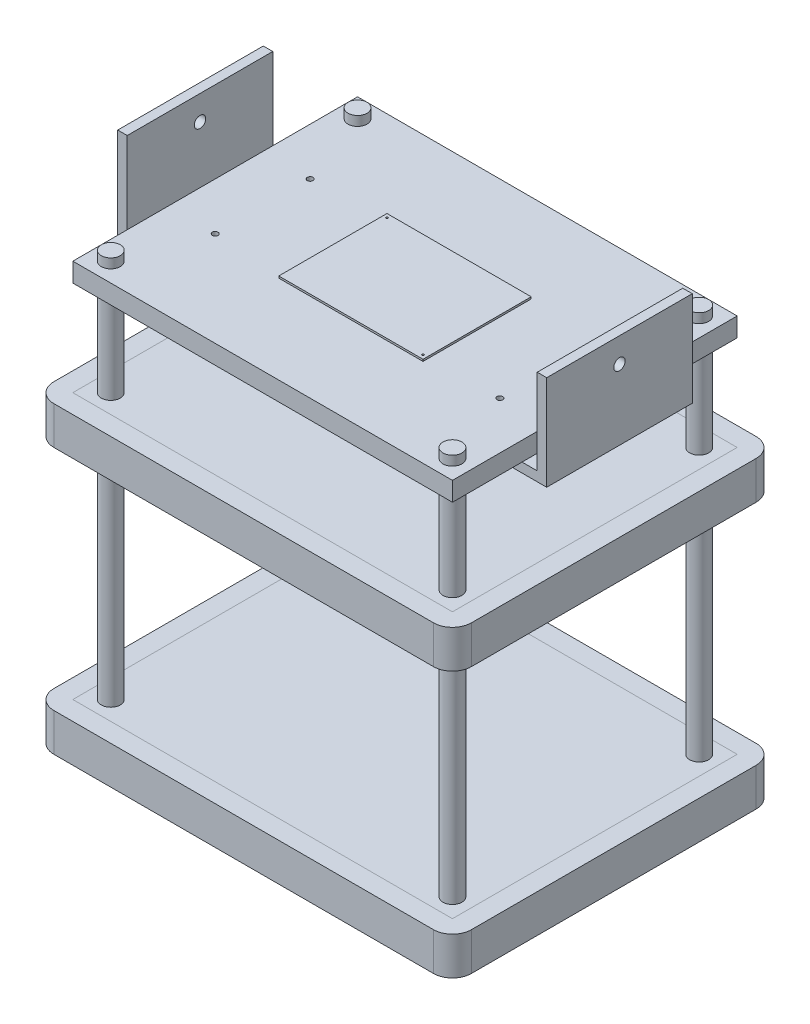
from build123d import *

# Parameters (mm, degrees)
SKETCH1_W            = 200
SKETCH1_H            = 150
BOSS_EXTRUDE1_DEPTH  = 10
SKETCH2_R            = 5
CUT_EXTRUDE1_DEPTH   = 10
SKETCH3_W            = 200
SKETCH3_H            = 150
SKETCH3_R            = 5
BOSS_EXTRUDE2_DEPTH  = 10
SKETCH4_W            = 200
SKETCH4_H            = 150
SKETCH4_R            = 5
BOSS_EXTRUDE3_DEPTH  = 10
BOSS_EXTRUDE13_START = 205
SKETCH21_R           = 5
BOSS_EXTRUDE13_DEPTH = 205
SKETCH22_R           = 5
BOSS_EXTRUDE14_DEPTH = 15
SKETCH23_R           = 1.5
CUT_EXTRUDE2_DEPTH   = 10
SKETCH27_W           = 76
SKETCH27_H           = 57
BOSS_EXTRUDE16_DEPTH = 1
SKETCH30_R           = 0.5
CUT_EXTRUDE3_DEPTH   = 30
SKETCH35_W           = 220
SKETCH35_H           = 170
SKETCH35_W_2         = 200
SKETCH35_H_2         = 150
BOSS_EXTRUDE19_DEPTH = 10
FILLET4_R            = 10
SKETCH39_W           = 220
SKETCH39_H           = 170
SKETCH39_W_2         = 200
SKETCH39_H_2         = 150
BOSS_EXTRUDE20_DEPTH = 10
FILLET5_R            = 10
SKETCH42_W           = 15
SKETCH42_H           = 20
SKETCH42_W_2         = 55
SKETCH42_H_2         = 65
SKETCH42_W_3         = 43.3
SKETCH42_H_3         = 43.3
BOSS_EXTRUDE23_DEPTH = 1
SKETCH46_W           = 30
SKETCH46_H           = 76.670556204
BOSS_EXTRUDE24_DEPTH = 5
SKETCH48_W           = 76.670556204
SKETCH48_H           = 50
BOSS_EXTRUDE25_DEPTH = 5
SKETCH49_R           = 3
CUT_EXTRUDE4_DEPTH   = 5
SKETCH54_W           = 76.670556204
SKETCH54_H           = 50
BOSS_EXTRUDE26_DEPTH = 5
CUT_EXTRUDE5_START   = -5
SKETCH55_R           = 3
CUT_EXTRUDE5_DEPTH   = 5


with BuildPart() as part:
    # Sketch1 → Boss-Extrude1 (new body)
    with BuildSketch(Plane(origin=(0, 0, 0), x_dir=(1, 0, 0), z_dir=(0, 1, 0))):
        Rectangle(SKETCH1_W, SKETCH1_H)
    extrude(amount=BOSS_EXTRUDE1_DEPTH)

    # Sketch2 → Cut-Extrude1 (cut)
    with BuildSketch(Plane(origin=(0, 10, 0), x_dir=(1, 0, 0), z_dir=(0, 1, 0))):
        with Locations(Location((-90, 65, 0), (0, 0, 270))):
            Circle(SKETCH2_R)
        with Locations(Location((90, 65, 0), (0, 0, 90))):
            Circle(SKETCH2_R)
        with Locations(Location((90, -65, 0), (0, 0, 270))):
            Circle(SKETCH2_R)
        with Locations(Location((-90, -65, 0), (0, 0, 90))):
            Circle(SKETCH2_R)
    extrude(amount=-CUT_EXTRUDE1_DEPTH, mode=Mode.SUBTRACT)



with BuildPart() as body_2:
    # Sketch3 → Boss-Extrude2 (new body)
    with BuildSketch(Plane(origin=(0, 140, 0), x_dir=(1, 0, 0), z_dir=(0, 1, 0))):
        Rectangle(SKETCH3_W, SKETCH3_H)
        with Locations(Location((-90, 65, 0), (0, 0, 270))):
            Circle(SKETCH3_R, mode=Mode.SUBTRACT)
        with Locations(Location((90, 65, 0), (0, 0, 90))):
            Circle(SKETCH3_R, mode=Mode.SUBTRACT)
        with Locations(Location((-90, -65, 0), (0, 0, 90))):
            Circle(SKETCH3_R, mode=Mode.SUBTRACT)
        with Locations(Location((90, -65, 0), (0, 0, 270))):
            Circle(SKETCH3_R, mode=Mode.SUBTRACT)
    extrude(amount=BOSS_EXTRUDE2_DEPTH)



with BuildPart() as body_3:
    # Sketch4 → Boss-Extrude3 (new body)
    with BuildSketch(Plane(origin=(0, 200, 0), x_dir=(1, 0, 0), z_dir=(0, 1, 0))):
        Rectangle(SKETCH4_W, SKETCH4_H)
        with Locations(Location((-90, 65, 0), (0, 0, 270))):
            Circle(SKETCH4_R, mode=Mode.SUBTRACT)
        with Locations(Location((90, 65, 0), (0, 0, 90))):
            Circle(SKETCH4_R, mode=Mode.SUBTRACT)
        with Locations(Location((90, -65, 0), (0, 0, 270))):
            Circle(SKETCH4_R, mode=Mode.SUBTRACT)
        with Locations(Location((-90, -65, 0), (0, 0, 90))):
            Circle(SKETCH4_R, mode=Mode.SUBTRACT)
    extrude(amount=BOSS_EXTRUDE3_DEPTH)


with BuildPart() as body_2_1:
    add(body_2.part)

    add(body_3.part)  # Boss-Extrude13 merges body 3
    # Sketch21 → Boss-Extrude13 (add)
    with BuildSketch(Plane(origin=(0, 10, 0), x_dir=(1, 0, 0), z_dir=(0, 1, 0)).offset(BOSS_EXTRUDE13_START)):
        with Locations(Location((-90, -65, 0), (0, 0, 90))):
            Circle(SKETCH21_R)
        with Locations(Location((-90, 65, 0), (0, 0, 270))):
            Circle(SKETCH21_R)
        with Locations(Location((90, 65, 0), (0, 0, 90))):
            Circle(SKETCH21_R)
        with Locations(Location((90, -65, 0), (0, 0, 270))):
            Circle(SKETCH21_R)
    extrude(amount=-BOSS_EXTRUDE13_DEPTH)


with BuildPart() as part_1:
    add(part.part)

    add(body_2_1.part)  # Boss-Extrude14 merges body 2
    # Sketch22 → Boss-Extrude14 (add)
    with BuildSketch(Plane(origin=(0, 10, 0), x_dir=(1, 0, 0), z_dir=(0, 1, 0))):
        with Locations(Location((-90, 65, 0), (0, 0, 270))):
            Circle(SKETCH22_R)
        with Locations(Location((-90, -65, 0), (0, 0, 270))):
            Circle(SKETCH22_R)
        with Locations(Location((90, -65, 0), (0, 0, 270))):
            Circle(SKETCH22_R)
        with Locations(Location((90, 65, 0), (0, 0, 270))):
            Circle(SKETCH22_R)
    extrude(amount=-BOSS_EXTRUDE14_DEPTH)

    # Sketch23 → Cut-Extrude2 (cut)
    with BuildSketch(Plane(origin=(0, 210, 0), x_dir=(1, 0, 0), z_dir=(0, 1, 0))):
        with Locations(Location((-75, 25, 0), (0, 0, 270))):
            Circle(SKETCH23_R)
        with Locations(Location((-75, -25, 0), (0, 0, 90))):
            Circle(SKETCH23_R)
        with Locations(Location((75, -25, 0), (0, 0, 270))):
            Circle(SKETCH23_R)
        with Locations(Location((75, 25, 0), (0, 0, 90))):
            Circle(SKETCH23_R)
    extrude(amount=-CUT_EXTRUDE2_DEPTH, mode=Mode.SUBTRACT)

    # Sketch27 → Boss-Extrude16 (add)
    with BuildSketch(Plane(origin=(0, 210, 0), x_dir=(1, 0, 0), z_dir=(0, 1, 0))):
        Rectangle(SKETCH27_W, SKETCH27_H)
    extrude(amount=BOSS_EXTRUDE16_DEPTH)

    # Sketch30 → Cut-Extrude3 (cut)
    with BuildSketch(Plane(origin=(0, 211, 0), x_dir=(1, 0, 0), z_dir=(0, 1, 0))):
        with Locations(Location((-36, 26.5, 0), (0, 0, 270))):
            Circle(SKETCH30_R)
        with Locations(Location((36, -26.5, 0), (0, 0, 270))):
            Circle(SKETCH30_R)
    extrude(amount=-CUT_EXTRUDE3_DEPTH, mode=Mode.SUBTRACT)

    # Sketch42 → Boss-Extrude23 (add)
    with BuildSketch(Plane.XZ.offset(-200)):
        Rectangle(SKETCH42_W, SKETCH42_H)
        with Locations((-43.240305189, 0.303312526)):
            Rectangle(SKETCH42_W_2, SKETCH42_H_2)
        with Locations((37.35, 2.211754737)):
            Rectangle(SKETCH42_W_3, SKETCH42_H_3)
    extrude(amount=BOSS_EXTRUDE23_DEPTH)

    # Sketch46 → Boss-Extrude24 (add)
    with BuildSketch(Plane(origin=(0, 200, 0), x_dir=(-1, 0, 0), z_dir=(0, -1, 0))):
        with Locations((-93, 0)):
            Rectangle(SKETCH46_W, SKETCH46_H)
        with Locations((93, 0)):
            Rectangle(SKETCH46_W, SKETCH46_H)
    extrude(amount=BOSS_EXTRUDE24_DEPTH)

    # Sketch48 → Boss-Extrude25 (add)
    with BuildSketch(Plane.ZY.offset(108)):
        with Locations((0, 220)):
            Rectangle(SKETCH48_W, SKETCH48_H)
    extrude(amount=BOSS_EXTRUDE25_DEPTH)

    # Sketch49 → Cut-Extrude4 (cut)
    with BuildSketch(Plane.ZY.offset(113)):
        with Locations((0, 232)):
            Circle(SKETCH49_R)
    extrude(amount=-CUT_EXTRUDE4_DEPTH, mode=Mode.SUBTRACT)

    # Sketch54 → Boss-Extrude26 (add)
    with BuildSketch(Plane(origin=(108, 0, 0), x_dir=(0, 0, -1), z_dir=(1, 0, 0))):
        with Locations((0, 220)):
            Rectangle(SKETCH54_W, SKETCH54_H)
    extrude(amount=BOSS_EXTRUDE26_DEPTH)

    # Sketch55 → Cut-Extrude5 (cut)
    with BuildSketch(Plane(origin=(113, 0, 0), x_dir=(0, 0, -1), z_dir=(1, 0, 0)).offset(CUT_EXTRUDE5_START)):
        with Locations(Location((0, 232, 0), (0, 0, 180))):
            Circle(SKETCH55_R)
    extrude(amount=CUT_EXTRUDE5_DEPTH, mode=Mode.SUBTRACT)


with BuildPart() as body_2_2:
    # Sketch35 → Boss-Extrude19 (new, symmetric)
    with BuildSketch(Plane(origin=(0, 0, 0), x_dir=(-1, 0, 0), z_dir=(0, -1, 0))):
        Rectangle(SKETCH35_W, SKETCH35_H)
        Rectangle(SKETCH35_W_2, SKETCH35_H_2, mode=Mode.SUBTRACT)
    extrude(amount=BOSS_EXTRUDE19_DEPTH, both=True)

    # Fillet4
    fillet4_edges = [body_2_2.edges().sort_by_distance(p)[0] for p in [
        (110, 0, -85),
        (-110, 0, -85),
        (-110, 0, 85),
        (110, 0, 85),
    ]]
    fillet(fillet4_edges, radius=FILLET4_R)


with BuildPart() as body_3_2:
    # Sketch39 → Boss-Extrude20 (new, symmetric)
    with BuildSketch(Plane.XZ.offset(-140)):
        Rectangle(SKETCH39_W, SKETCH39_H)
        Rectangle(SKETCH39_W_2, SKETCH39_H_2, mode=Mode.SUBTRACT)
    extrude(amount=BOSS_EXTRUDE20_DEPTH, both=True)

    # Fillet5
    fillet5_edges = [body_3_2.edges().sort_by_distance(p)[0] for p in [
        (110, 140, -85),
        (-110, 140, -85),
        (-110, 140, 85),
        (110, 140, 85),
    ]]
    fillet(fillet5_edges, radius=FILLET5_R)


solid = Compound([part_1.part, body_2_2.part, body_3_2.part])
